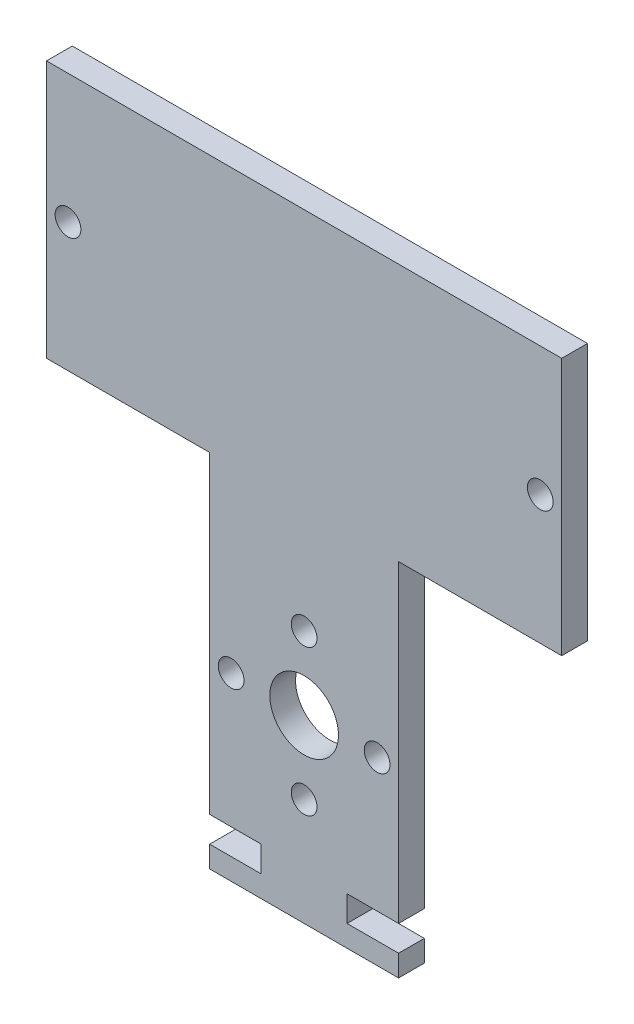
from build123d import *

# Parameters (mm, degrees)
SKETCH1_R           = 1.5
SKETCH1_R_2         = 4
BOSS_EXTRUDE1_DEPTH = 3


with BuildPart() as part:
    # Sketch1 → Boss-Extrude1 (new body)
    with BuildSketch(Plane.XY):
        Polygon((-11, 0), (-11, -15.5), (-5, -15.5), (-5, -18.5), (-11, -18.5), (-11, -21), (11, -21), (11, -18.5), (5, -18.5), (5, -15.5), (11, -15.5), (11, 0), (11, 21), (30, 21), (30, 51), (-30, 51), (-30, 21), (-11, 21), align=None)
        with Locations((0, 8.5)):
            Circle(SKETCH1_R, mode=Mode.SUBTRACT)
        with Locations((8.5, 0)):
            Circle(SKETCH1_R, mode=Mode.SUBTRACT)
        with Locations((0, -8.5)):
            Circle(SKETCH1_R, mode=Mode.SUBTRACT)
        with Locations((-8.5, 0)):
            Circle(SKETCH1_R, mode=Mode.SUBTRACT)
        with Locations((-27.5, 36)):
            Circle(SKETCH1_R, mode=Mode.SUBTRACT)
        with Locations((27.5, 36)):
            Circle(SKETCH1_R, mode=Mode.SUBTRACT)
        Circle(SKETCH1_R_2, mode=Mode.SUBTRACT)
    extrude(amount=BOSS_EXTRUDE1_DEPTH)


solid = part.part
